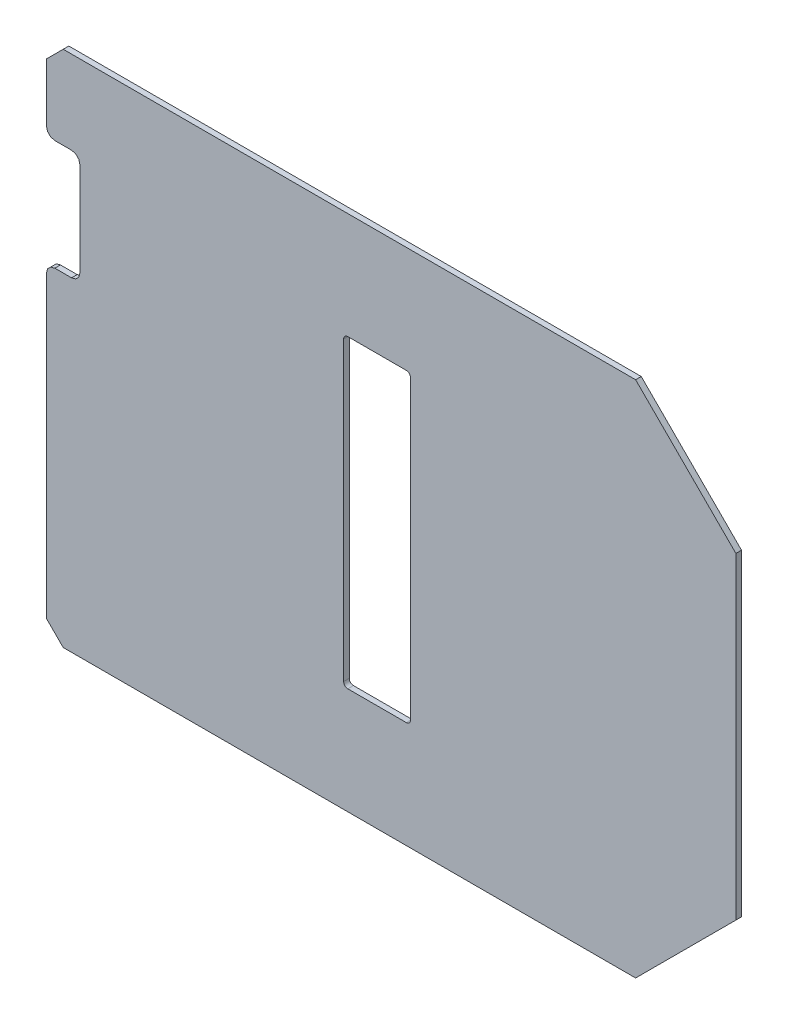
from build123d import *

# Parameters (mm, degrees)
BOSS_EXTRUDE1_DEPTH = 6.720839839
SKETCH2_W           = 80
SKETCH2_H           = 365
CUT_EXTRUDE1_DEPTH  = 517.04400614
FILLET1_R           = 5


with BuildPart() as part:
    # Sketch1 → Boss-Extrude1 (new body)
    with BuildSketch(Plane(origin=(0, 0, 0), x_dir=(-1.0, 0, 1.2419204428734467e-09), z_dir=(-1.2419204428734467e-09, 1.2419185922687681e-09, -1.0))):
        Polygon((372.500002384, 200.349256396), (373.839735985, 205.349251628), (377.499997616, 209.009498358), (382.499992847, 210.34924686), (402.500003576, 210.34924686), (407.499998808, 211.688995361), (411.160260439, 215.349256992), (412.49999404, 220.349252224), (412.49999404, 289.999991655), (392.500013113, 310.000002384), (-292.499989271, 310.000002384), (-412.49999404, 189.999997616), (-412.49999404, -189.999997616), (-292.499989271, -310.000002384), (392.500013113, -310.000002384), (412.49999404, -289.999991655), (412.49999404, 68.113133311), (411.160260439, 73.113135993), (407.499998808, 76.773390174), (402.500003576, 78.113131225), (382.499992847, 78.113131225), (377.499997616, 79.452879727), (373.839735985, 83.113133907), (372.500002384, 88.11313659), align=None)
    extrude(amount=-BOSS_EXTRUDE1_DEPTH)

    # Sketch2 → Cut-Extrude1 (cut, through all)
    with BuildSketch(Plane(origin=(0, 0, 0), x_dir=(-1.0, 0, 1.2419204428734473e-09), z_dir=(-1.2419204428734473e-09, 1.241918592268768e-09, -1.0))):
        with Locations((16.89999404, 0)):
            Rectangle(SKETCH2_W, SKETCH2_H)
    extrude(amount=-CUT_EXTRUDE1_DEPTH, mode=Mode.SUBTRACT)

    # Fillet1
    fillet1_edges = [part.edges().sort_by_distance(p)[0] for p in [
        (23.100005965, -182.500000004, 3.360419664),
        (23.100005965, 182.499999996, 3.360420117),
        (-56.899994035, 182.499999996, 3.360420217),
        (-56.899994035, -182.500000004, 3.360419763),
    ]]
    fillet(fillet1_edges, radius=FILLET1_R)


solid = part.part
